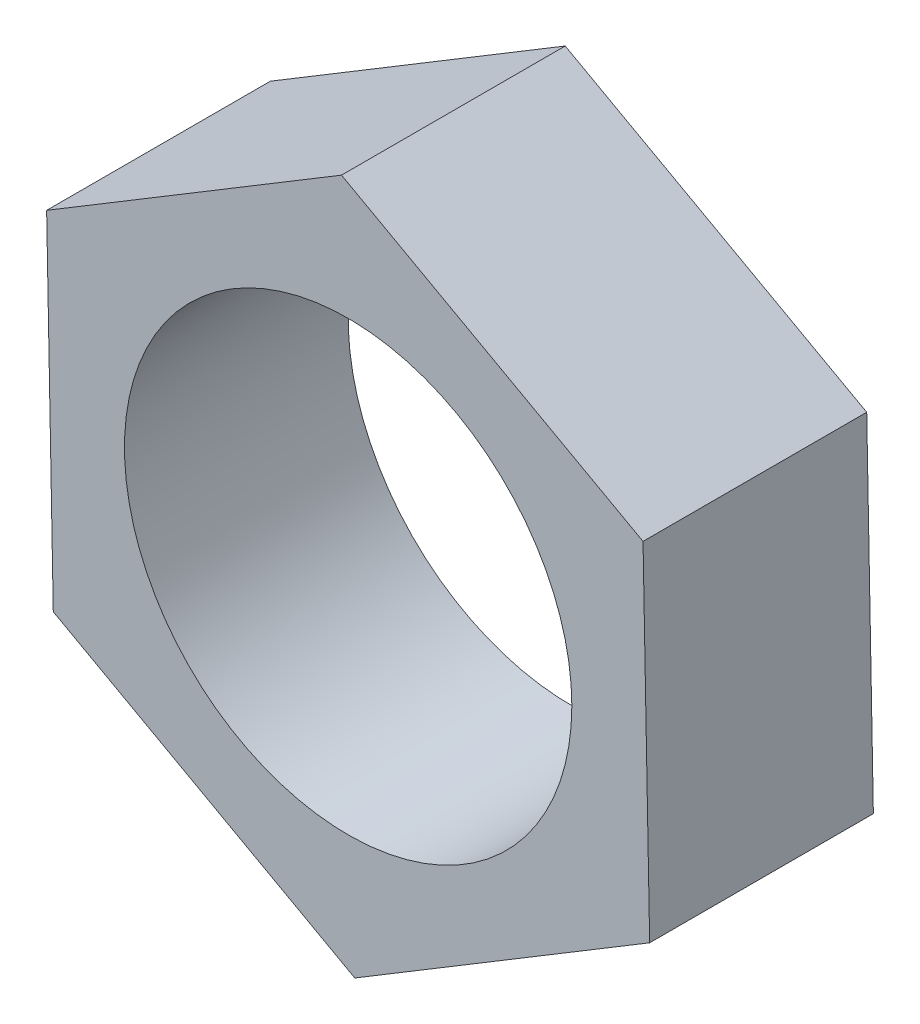
from build123d import *

# Parameters (mm, degrees)
BOSS_EXTRUDE1_DEPTH = 3
SKETCH2_R           = 3
CUT_EXTRUDE1_DEPTH  = 20


with BuildPart() as part:
    # Sketch1 → Boss-Extrude1 (new body)
    with BuildSketch(Plane.XY):
        Polygon((3.954729908, 2.386094023), (-0.089053085, 4.617943577), (-4.043782994, 2.231849554), (-3.954729908, -2.386094023), (0.089053085, -4.617943577), (4.043782994, -2.231849554), align=None)
    extrude(amount=BOSS_EXTRUDE1_DEPTH)

    # Sketch2 → Cut-Extrude1 (cut)
    with BuildSketch(Plane.XY.offset(3)):
        Circle(SKETCH2_R)
    extrude(amount=-CUT_EXTRUDE1_DEPTH, mode=Mode.SUBTRACT)


solid = part.part
